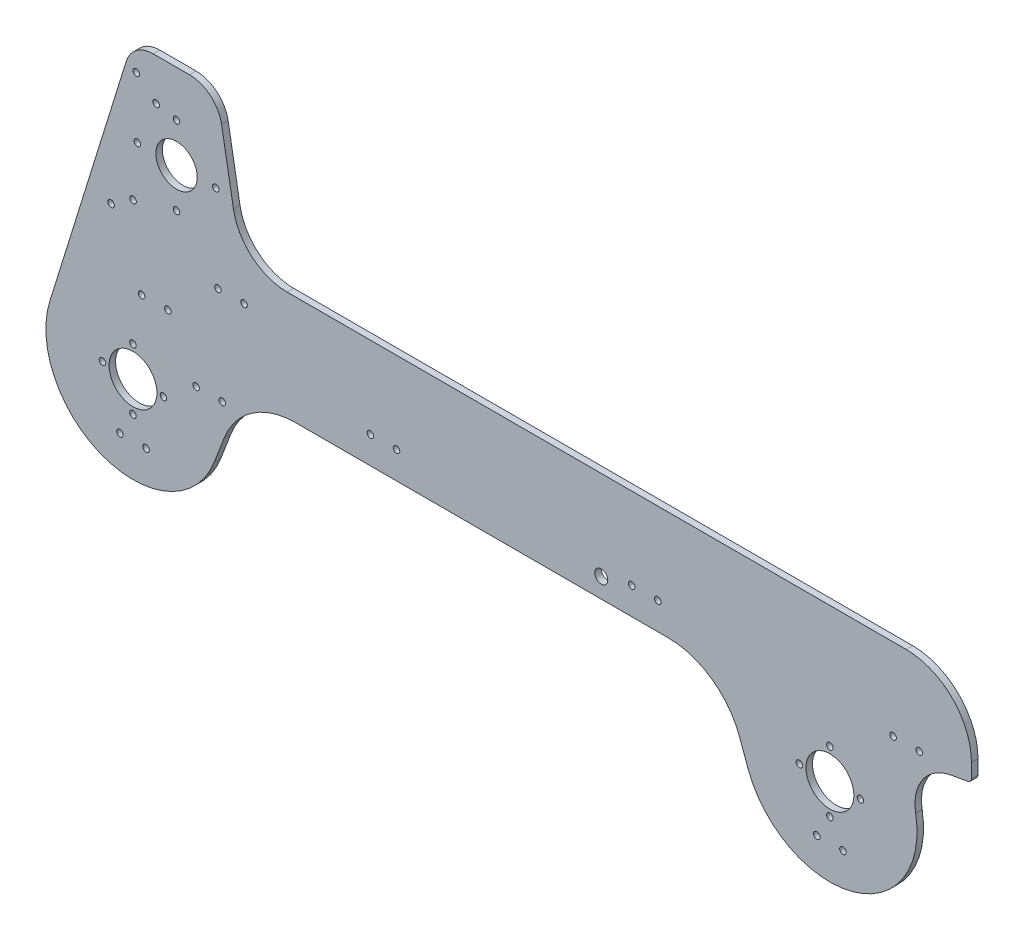
from build123d import *

# Parameters (mm, degrees)
MODEL_R         = 11
MODEL_R_2       = 9.5
MODEL_R_3       = 1.5
MODEL_R_4       = 3
EXTRUDE_1_DEPTH = 3


with BuildPart() as part:
    # Model → 凸台-拉伸1 (new body)
    with BuildSketch(Plane.XY):
        with BuildLine():
            Line((1088.508697922, 149.67262706), (1083.05209603, 180.618554166))
            ThreePointArc((1083.05209603, 180.618554166), (1077.92179388, 189.504498148), (1068.279979735, 193.013831501))
            Line((1068.279979735, 193.013831501), (1051.677026847, 193.013831501))
            ThreePointArc((1051.677026847, 193.013831501), (1043.967976827, 190.481426631), (1039.262378471, 183.870838854))
            Line((1039.262378471, 183.870838854), (1004.158643075, 70.881546432))
            ThreePointArc((1004.158643075, 70.881546432), (1029.249360335, 21.222627878), (1079.700778213, 44.67911352))
            Line((1079.700778213, 44.67911352), (1084.260160223, 56.556709735))
            ThreePointArc((1084.260160223, 56.556709735), (1097.111256858, 72.858248103), (1116.93547515, 79.013831501))
            Line((1116.93547515, 79.013831501), (1288.003781731, 79.013831501))
            ThreePointArc((1288.003781731, 79.013831501), (1308.078957003, 72.684153051), (1320.893023458, 55.984536518))
            Line((1320.893023458, 55.984536518), (1324.769856321, 45.333025768))
            ThreePointArc((1324.769856321, 45.333025768), (1372.710322957, 20.37679845), (1401.749871273, 65.959758608))
            Line((1401.749871273, 65.959758608), (1401.710502358, 66.183030822))
            ThreePointArc((1401.710502358, 66.183030822), (1405.023616532, 81.127523103), (1417.933693865, 89.352149436))
            Line((1417.933693865, 89.352149436), (1425.704857508, 90.722415258))
            ThreePointArc((1425.704857508, 90.722415258), (1426.889650039, 91.406455544), (1427.357561153, 92.692030764))
            Line((1427.357561153, 92.692030764), (1427.357561153, 99.013831501))
            ThreePointArc((1427.357561153, 99.013831501), (1418.570764588, 120.227034937), (1397.357561153, 129.013831501))
            Line((1397.357561153, 129.013831501), (1113.128891747, 129.013831501))
            ThreePointArc((1113.128891747, 129.013831501), (1097.059201505, 134.862720423), (1088.508697922, 149.67262706))
        make_face()
        with Locations((1362.357561153, 59.013831501)):
            Circle(MODEL_R, mode=Mode.SUBTRACT)
        with Locations((1042.357561153, 59.013831501)):
            Circle(MODEL_R, mode=Mode.SUBTRACT)
        with Locations((1062.357561153, 154.013831501)):
            Circle(MODEL_R_2, mode=Mode.SUBTRACT)
        with Locations((1151.357561153, 91.513831501)):
            Circle(MODEL_R_3, mode=Mode.SUBTRACT)
        with Locations((1163.357561153, 91.513831501)):
            Circle(MODEL_R_3, mode=Mode.SUBTRACT)
        with Locations((1271.357561153, 91.513831501)):
            Circle(MODEL_R_3, mode=Mode.SUBTRACT)
        with Locations((1283.357561153, 91.513831501)):
            Circle(MODEL_R_3, mode=Mode.SUBTRACT)
        with Locations((1391.357561153, 91.513831501)):
            Circle(MODEL_R_3, mode=Mode.SUBTRACT)
        with Locations((1403.357561153, 91.513831501)):
            Circle(MODEL_R_3, mode=Mode.SUBTRACT)
        with Locations((1093.357561153, 114.513831501)):
            Circle(MODEL_R_3, mode=Mode.SUBTRACT)
        with Locations((1081.357561153, 114.513831501)):
            Circle(MODEL_R_3, mode=Mode.SUBTRACT)
        with Locations((1046.357561153, 94.513831501)):
            Circle(MODEL_R_3, mode=Mode.SUBTRACT)
        with Locations((1058.357561153, 94.513831501)):
            Circle(MODEL_R_3, mode=Mode.SUBTRACT)
        with Locations((1071.357561153, 70.513831501)):
            Circle(MODEL_R_3, mode=Mode.SUBTRACT)
        with Locations((1083.357561153, 70.513831501)):
            Circle(MODEL_R_3, mode=Mode.SUBTRACT)
        with Locations((1036.357561153, 34.513831501)):
            Circle(MODEL_R_3, mode=Mode.SUBTRACT)
        with Locations((1048.357561153, 34.513831501)):
            Circle(MODEL_R_3, mode=Mode.SUBTRACT)
        with Locations((1356.357561153, 34.513831501)):
            Circle(MODEL_R_3, mode=Mode.SUBTRACT)
        with Locations((1368.357561153, 34.513831501)):
            Circle(MODEL_R_3, mode=Mode.SUBTRACT)
        with Locations((1062.357561153, 172.013831501)):
            Circle(MODEL_R_3, mode=Mode.SUBTRACT)
        with Locations((1080.357561153, 154.013831501)):
            Circle(MODEL_R_3, mode=Mode.SUBTRACT)
        with Locations((1062.357561153, 136.013831501)):
            Circle(MODEL_R_3, mode=Mode.SUBTRACT)
        with Locations((1044.357561153, 154.013831501)):
            Circle(MODEL_R_3, mode=Mode.SUBTRACT)
        with Locations((1042.380322879, 130.30919164)):
            Circle(MODEL_R_3, mode=Mode.SUBTRACT)
        with Locations((1032.316276064, 123.77352322)):
            Circle(MODEL_R_3, mode=Mode.SUBTRACT)
        with Locations((1042.357561153, 73.013831501)):
            Circle(MODEL_R_3, mode=Mode.SUBTRACT)
        with Locations((1056.357561153, 59.013831501)):
            Circle(MODEL_R_3, mode=Mode.SUBTRACT)
        with Locations((1042.357561153, 45.013831501)):
            Circle(MODEL_R_3, mode=Mode.SUBTRACT)
        with Locations((1028.357561153, 59.013831501)):
            Circle(MODEL_R_3, mode=Mode.SUBTRACT)
        with Locations((1362.357561153, 73.013831501)):
            Circle(MODEL_R_3, mode=Mode.SUBTRACT)
        with Locations((1376.357561153, 59.013831501)):
            Circle(MODEL_R_3, mode=Mode.SUBTRACT)
        with Locations((1362.357561153, 45.013831501)):
            Circle(MODEL_R_3, mode=Mode.SUBTRACT)
        with Locations((1348.357561153, 59.013831501)):
            Circle(MODEL_R_3, mode=Mode.SUBTRACT)
        with Locations((1257.357561153, 88.013831501)):
            Circle(MODEL_R_4, mode=Mode.SUBTRACT)
        with Locations((1043.885858479, 181.699972429)):
            Circle(MODEL_R_3, mode=Mode.SUBTRACT)
        with Locations((1052.99702044, 173.890572471)):
            Circle(MODEL_R_3, mode=Mode.SUBTRACT)
    extrude(amount=EXTRUDE_1_DEPTH)


solid = part.part
